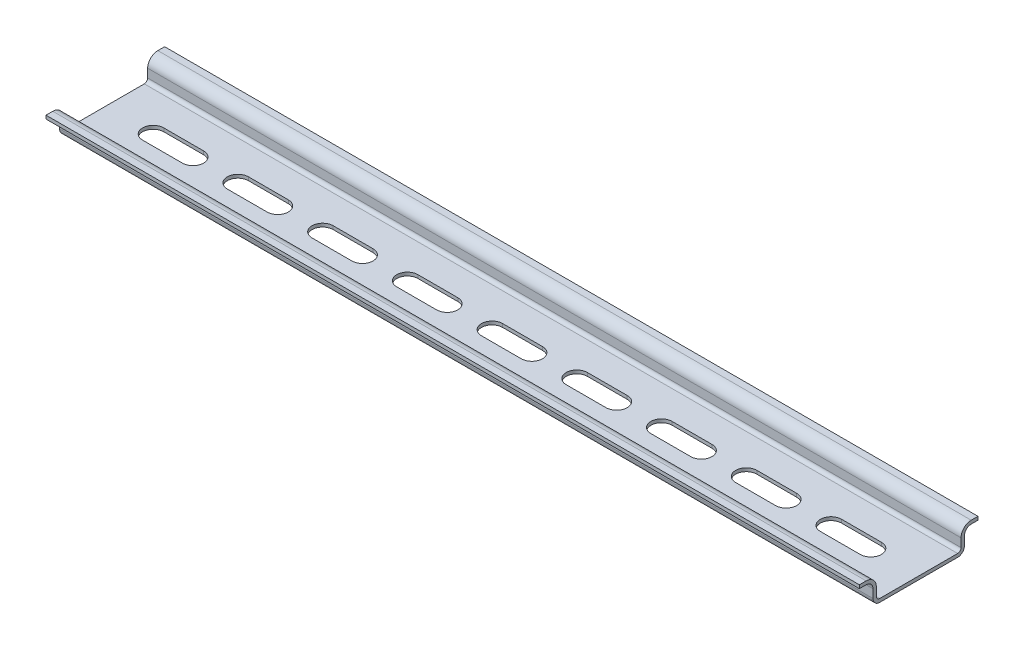
from build123d import *

# Parameters (mm, degrees)
EXTRUDE_THIN1_DEPTH      = 120
EXTRUDE_THIN1_DEPTH_BACK = 120
CUT_EXTRUDE1_REACH       = 123.501
LPATTERN1_COUNT          = 5
LPATTERN1_PITCH          = 25
LPATTERN1_COL_COUNT      = 5
LPATTERN1_COL_PITCH      = 25


with BuildPart() as part:
    # Sketch1 → Extrude-Thin1 (new, two sides: drawn at the far end of the back side and taken through both)
    with BuildSketch(Plane(origin=(0, 0, 0), x_dir=(0, 0, -1), z_dir=(1, 0, 0)).offset(-EXTRUDE_THIN1_DEPTH_BACK)):
        with BuildLine():
            Line((-17.5, 6.5), (-15.5, 6.5))
            ThreePointArc((-15.5, 6.5), (-14.085786438, 5.914213562), (-13.5, 4.5))
            Line((-13.5, 4.5), (-13.5, 2))
            ThreePointArc((-13.5, 2), (-12.914213562, 0.585786438), (-11.5, 0))
            Line((-11.5, 0), (11.5, 0))
            ThreePointArc((11.5, 0), (12.914213562, 0.585786438), (13.5, 2))
            Line((13.5, 2), (13.5, 4.5))
            ThreePointArc((13.5, 4.5), (14.085786438, 5.914213562), (15.5, 6.5))
            Line((15.5, 6.5), (17.5, 6.5))
            Line((17.5, 6.5), (17.5, 7.5))
            Line((17.5, 7.5), (15.5, 7.5))
            ThreePointArc((15.5, 7.5), (13.378679656, 6.621320344), (12.5, 4.5))
            Line((12.5, 4.5), (12.5, 2))
            ThreePointArc((12.5, 2), (12.207106781, 1.292893219), (11.5, 1))
            Line((11.5, 1), (-11.5, 1))
            ThreePointArc((-11.5, 1), (-12.207106781, 1.292893219), (-12.5, 2))
            Line((-12.5, 2), (-12.5, 4.5))
            ThreePointArc((-12.5, 4.5), (-13.378679656, 6.621320344), (-15.5, 7.5))
            Line((-15.5, 7.5), (-17.5, 7.5))
            Line((-17.5, 7.5), (-17.5, 6.5))
        make_face()
    extrude(amount=EXTRUDE_THIN1_DEPTH + EXTRUDE_THIN1_DEPTH_BACK)

    # Sketch2 → Cut-Extrude1 (cut, up to next)
    with BuildSketch(Plane.XZ, mode=Mode.PRIVATE) as cut_extrude1_sk1:
        with BuildLine():
            Line((-5.875, 3.125), (5.875, 3.125))
            ThreePointArc((5.875, 3.125), (9, 0), (5.875, -3.125))
            Line((5.875, -3.125), (-5.875, -3.125))
            ThreePointArc((-5.875, -3.125), (-9, 0), (-5.875, 3.125))
        make_face()
    cut_extrude1_tool1 = extrude(cut_extrude1_sk1.sketch, amount=-CUT_EXTRUDE1_REACH, mode=Mode.PRIVATE) & part.part
    cut_extrude1 = cut_extrude1_tool1.solids().sort_by_distance((0, 0, 0))[0]
    add(cut_extrude1, mode=Mode.SUBTRACT)

    # LPattern1: Cut-Extrude1 ×5
    with Locations(*[(i * LPATTERN1_PITCH, 0, 0) for i in range(1, LPATTERN1_COUNT)]):
        add(cut_extrude1, mode=Mode.SUBTRACT)

    # LPattern1 col: Cut-Extrude1 ×5
    with Locations(*[(-i * LPATTERN1_COL_PITCH, 0, 0) for i in range(1, LPATTERN1_COL_COUNT)]):
        add(cut_extrude1, mode=Mode.SUBTRACT)


solid = part.part
